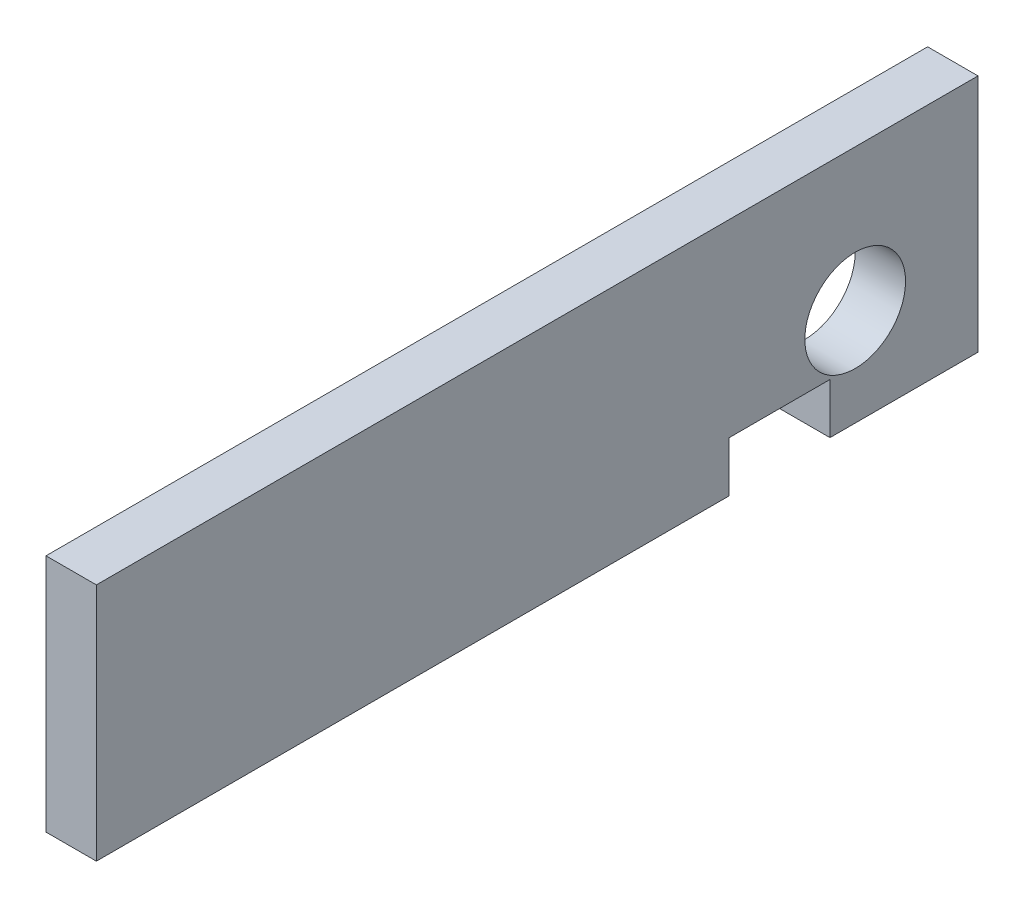
from build123d import *

# Parameters (mm, degrees)
SKETCH1_W          = 25.4
SKETCH1_H          = 120.65
EXTRUDE1_DEPTH     = 444.5
SKETCH2_R          = 25.4
CUT_EXTRUDE1_DEPTH = 25.4
CUT_EXTRUDE2_DEPTH = 50.8


with BuildPart() as part:
    # Sketch1 → Extrude1 (new body)
    with BuildSketch(Plane.XY):
        with Locations((0, 60.325)):
            Rectangle(SKETCH1_W, SKETCH1_H)
    extrude(amount=-EXTRUDE1_DEPTH)

    # Sketch2 → Cut-Extrude1 (cut, symmetric)
    with BuildSketch(Plane(origin=(0, 0, 0), x_dir=(0, 0, -1), z_dir=(1, 0, 0))):
        with Locations((382.5748, 49.2252)):
            Circle(SKETCH2_R)
    extrude(amount=CUT_EXTRUDE1_DEPTH, both=True, mode=Mode.SUBTRACT)

    # Sketch4 → Cut-Extrude2 (cut)
    with BuildSketch(Plane(origin=(0, 0, -369.8748), x_dir=(-1, 0, 0), z_dir=(0, 0, -1))):
        Polygon((-22.207602217, 34.907602217), (28.73114164, -16.03114164), (-22.207602217, -16.03114164), align=None)
    extrude(amount=-CUT_EXTRUDE2_DEPTH, mode=Mode.SUBTRACT)


solid = part.part
